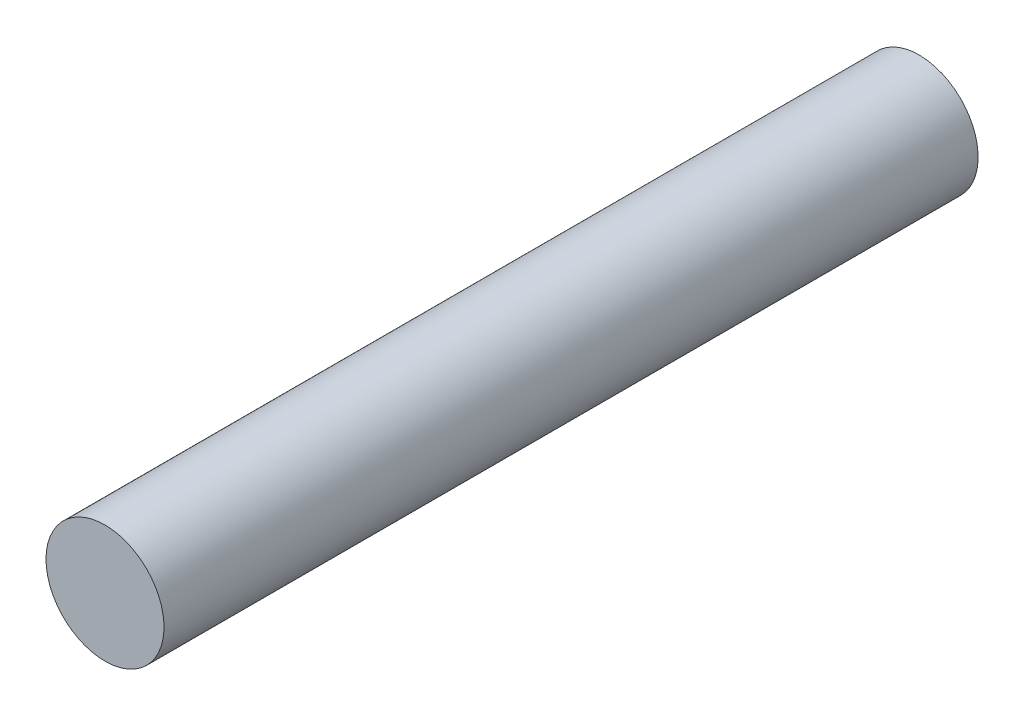
from build123d import *

# Parameters (mm, degrees)
ESQUISSE1_R        = 4
BOSS_EXTRU_1_DEPTH = 55.2


with BuildPart() as part:
    # Esquisse1 → Boss.-Extru.1 (new body)
    with BuildSketch(Plane.XY):
        with Locations(Location((0, 0, 0), (0, 0, 180))):
            Circle(ESQUISSE1_R)
    extrude(amount=BOSS_EXTRU_1_DEPTH)


solid = part.part
